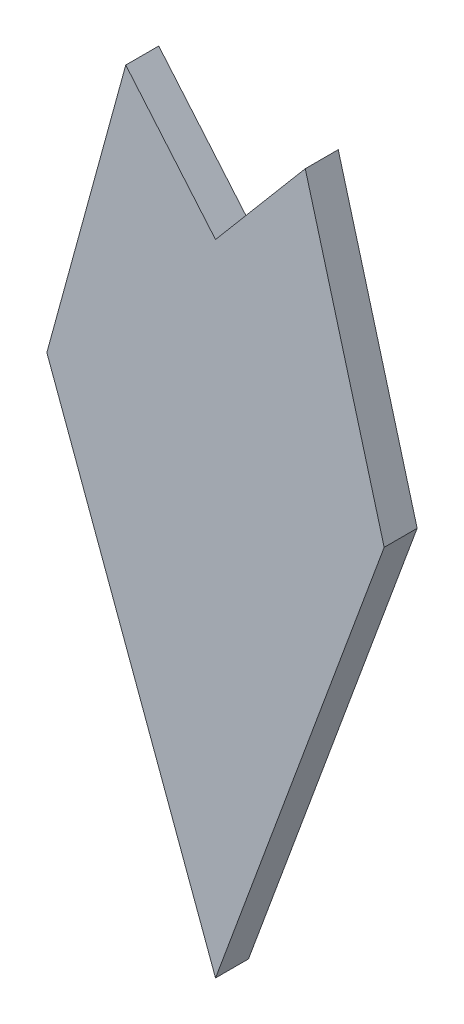
from build123d import *

# Parameters (mm, degrees)
BOSS_EXTRU_1_DEPTH = 0.5


with BuildPart() as part:
    # Esquisse1 → Boss.-Extru.1 (new body)
    with BuildSketch(Plane.XY):
        Polygon((27.207956928, 10.648220028), (26.011288148, 15.023189368), (24.65, 13.412193023), (23.288711852, 15.023189368), (22.092043072, 10.648220028), (24.65, 3.712982236), align=None)
    extrude(amount=BOSS_EXTRU_1_DEPTH)


solid = part.part
